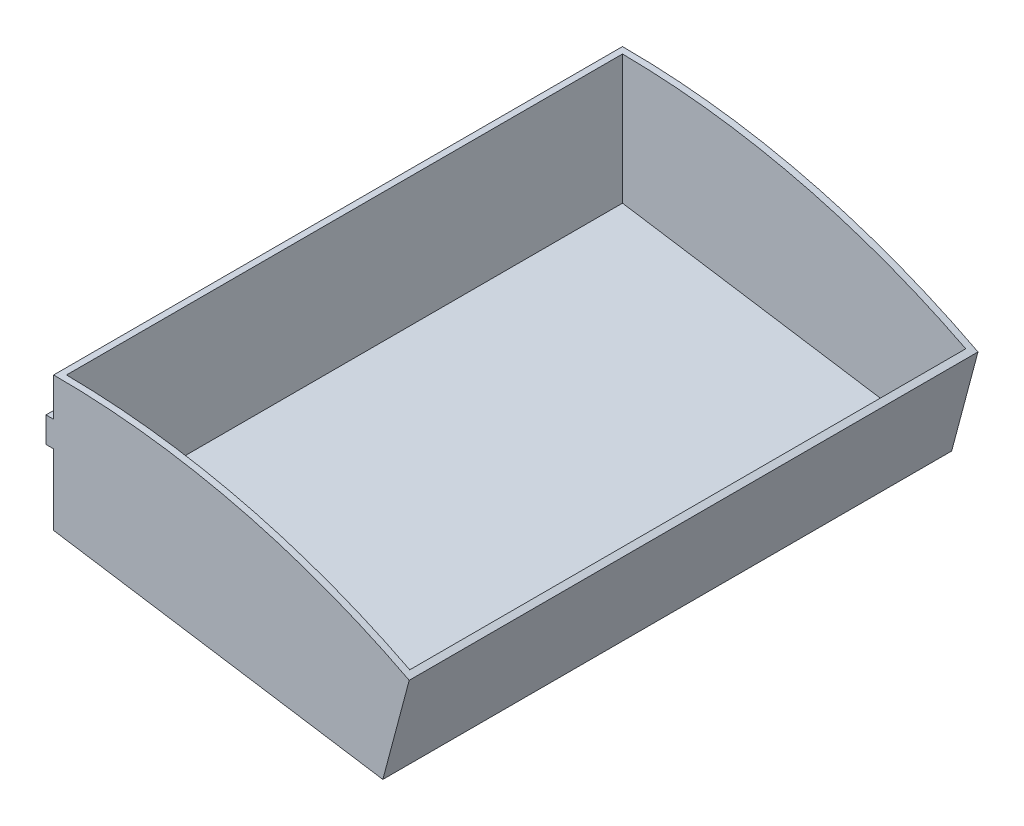
from build123d import *

# Parameters (mm, degrees)
BOSS_EXTRUDE1_DEPTH = 563.88
SHELL1_T            = -6.35
SKETCH2_W           = 563.88
SKETCH2_H           = 25.4
BOSS_EXTRUDE2_DEPTH = 7.62


with BuildPart() as part:
    # Sketch1 → Boss-Extrude1 (new body)
    with BuildSketch(Plane.XY):
        with BuildLine():
            Line((0, 0), (0, 133.572018751))
            ThreePointArc((0, 133.572018751), (181.379040374, 111.770166328), (352.425, 47.606650594))
            Line((352.425, 47.606650594), (326.303398408, -50.577981249))
            Line((326.303398408, -50.577981249), (0, 0))
        make_face()
    extrude(amount=BOSS_EXTRUDE1_DEPTH)

    # Shell1
    shell1_openings = [part.faces().sort_by_distance(p)[0] for p in [
        (181.379040374, 111.770166328, 281.94),
    ]]
    offset(amount=SHELL1_T, openings=shell1_openings, kind=Kind.INTERSECTION)

    # Sketch2 → Boss-Extrude2 (add)
    with BuildSketch(Plane.ZY):
        with Locations((281.94, 82.772018751)):
            Rectangle(SKETCH2_W, SKETCH2_H)
    extrude(amount=BOSS_EXTRUDE2_DEPTH)


solid = part.part
